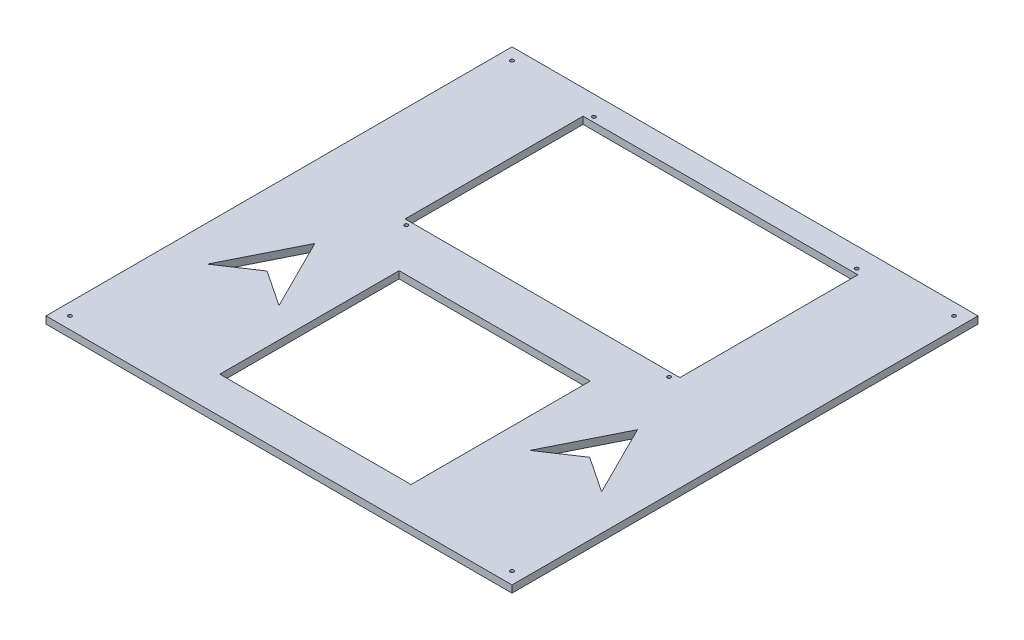
from build123d import *

# Parameters (mm, degrees)
SKETCH_2_W      = 390
SKETCH_2_H      = 390
SKETCH_2_R      = 1.5
SKETCH_2_W_2    = 230
SKETCH_2_H_2    = 149
SKETCH_2_W_3    = 160
SKETCH_2_H_3    = 150
EXTRUDE_1_DEPTH = 6


with BuildPart() as part:
    # 草图2 → 凸台-拉伸1 (new body)
    with BuildSketch(Plane(origin=(0, 0, 0), x_dir=(1, 0, 0), z_dir=(0, 1, 0))):
        Rectangle(SKETCH_2_W, SKETCH_2_H)
        with Locations(Location((185, -185, 0), (0, 0, 270))):
            Circle(SKETCH_2_R, mode=Mode.SUBTRACT)
        with Locations(Location((-185, 185, 0), (0, 0, 270))):
            Circle(SKETCH_2_R, mode=Mode.SUBTRACT)
        with Locations(Location((110, 21.5, 0), (0, 0, 270))):
            Circle(SKETCH_2_R, mode=Mode.SUBTRACT)
        with Locations(Location((-110, 178.5, 0), (0, 0, 270))):
            Circle(SKETCH_2_R, mode=Mode.SUBTRACT)
        with Locations(Location((-110, 21.5, 0), (0, 0, 270))):
            Circle(SKETCH_2_R, mode=Mode.SUBTRACT)
        with Locations(Location((110, 178.5, 0), (0, 0, 270))):
            Circle(SKETCH_2_R, mode=Mode.SUBTRACT)
        with Locations(Location((-185, -185, 0), (0, 0, 270))):
            Circle(SKETCH_2_R, mode=Mode.SUBTRACT)
        with Locations(Location((185, 185, 0), (0, 0, 270))):
            Circle(SKETCH_2_R, mode=Mode.SUBTRACT)
        with Locations((0, 100)):
            Rectangle(SKETCH_2_W_2, SKETCH_2_H_2, mode=Mode.SUBTRACT)
        with Locations((0, -89.5)):
            Rectangle(SKETCH_2_W_3, SKETCH_2_H_3, mode=Mode.SUBTRACT)
        Polygon((-135, -70), (-105, -90), (-135, -30), (-165, -90), align=None, mode=Mode.SUBTRACT)
        Polygon((135, -70), (165, -90), (135, -30), (105, -90), align=None, mode=Mode.SUBTRACT)
    extrude(amount=EXTRUDE_1_DEPTH)


solid = part.part
